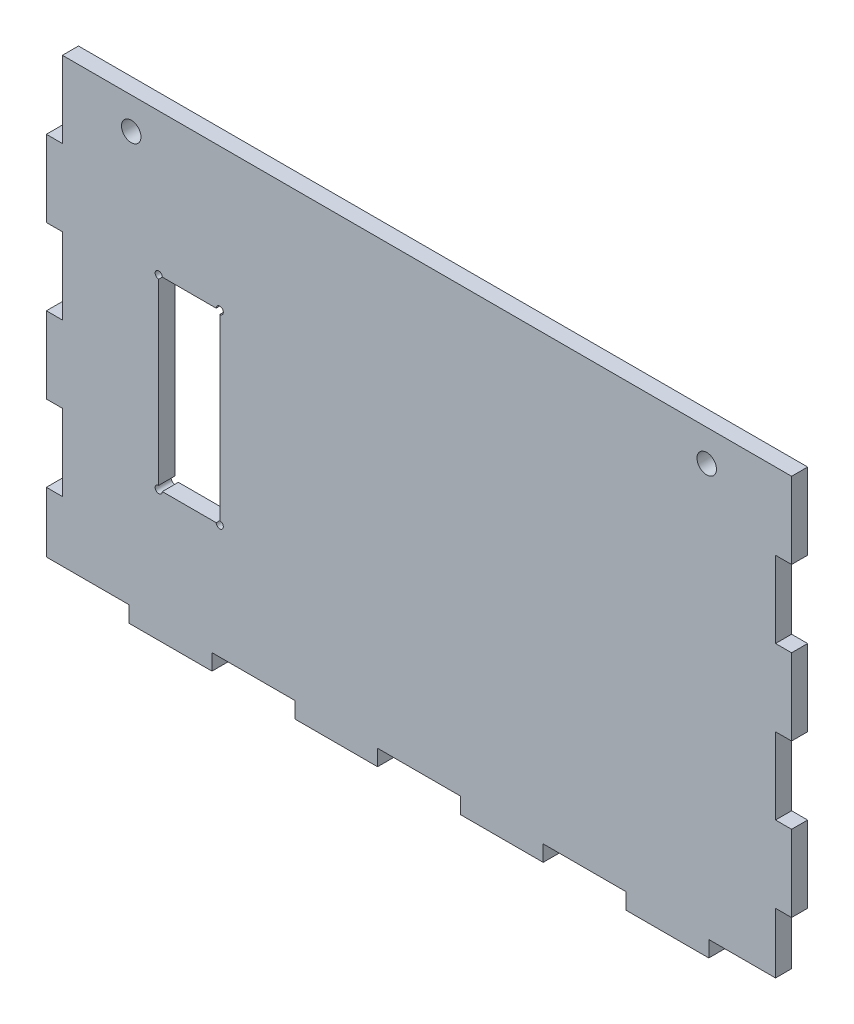
from build123d import *

# Parameters (mm, degrees)
SKETCH1_W           = 130
SKETCH1_H           = 80
BOSS_EXTRUDE1_DEPTH = 2.8
SKETCH2_W           = 14.444444444
SKETCH2_H           = 2.8
SKETCH2_W_2         = 2.8
SKETCH2_H_2         = 13.333333334
SKETCH2_H_3         = 13.333333333
CUT_EXTRUDE1_DEPTH  = 153.669053839
CUT_EXTRUDE2_REACH  = 154.669
SKETCH3_R           = 1.7
CUT_EXTRUDE3_REACH  = 154.669


with BuildPart() as part:
    # Sketch1 → Boss-Extrude1 (new body)
    with BuildSketch(Plane.XY):
        with Locations((65, 40)):
            Rectangle(SKETCH1_W, SKETCH1_H)
    extrude(amount=BOSS_EXTRUDE1_DEPTH)

    # Sketch2 → Cut-Extrude1 (cut, through all)
    with BuildSketch(Plane.XY.offset(2.8)):
        with Locations((7.222222222, 1.4)):
            Rectangle(SKETCH2_W, SKETCH2_H)
        with Locations((36.111111111, 1.4)):
            Rectangle(SKETCH2_W, SKETCH2_H)
        with Locations((65, 1.4)):
            Rectangle(SKETCH2_W, SKETCH2_H)
        with Locations((93.888888889, 1.4)):
            Rectangle(SKETCH2_W, SKETCH2_H)
        Polygon((115.555555556, 0), (115.555555556, 2.8), (127.2, 2.8), (127.2, 13.333333333), (130, 13.333333333), (130, 0), align=None)
        with Locations((1.4, 20)):
            Rectangle(SKETCH2_W_2, SKETCH2_H_2)
        with Locations((1.4, 46.666666667)):
            Rectangle(SKETCH2_W_2, SKETCH2_H_3)
        with Locations((1.4, 73.333333334)):
            Rectangle(SKETCH2_W_2, SKETCH2_H_3)
        with Locations((128.6, 33.333333334)):
            Rectangle(SKETCH2_W_2, SKETCH2_H_3)
        with Locations((128.6, 60)):
            Rectangle(SKETCH2_W_2, SKETCH2_H_2)
    extrude(amount=-CUT_EXTRUDE1_DEPTH, mode=Mode.SUBTRACT)

    # Sketch3 → Cut-Extrude2 (cut, up to next)
    with BuildSketch(Plane.XY.offset(2.8), mode=Mode.PRIVATE) as cut_extrude2_sk1:
        with Locations((14.8, 74.5)):
            Circle(SKETCH3_R)
    cut_extrude2_tool1 = extrude(cut_extrude2_sk1.sketch, amount=-CUT_EXTRUDE2_REACH, mode=Mode.PRIVATE) & part.part
    # Sketch3 → Cut-Extrude2 (cut, up to next)
    with BuildSketch(Plane.XY.offset(2.8), mode=Mode.PRIVATE) as cut_extrude2_sk2:
        with Locations(Location((115.2, 74.5, 0), (0, 0, 180))):
            Circle(SKETCH3_R)
    cut_extrude2_tool2 = extrude(cut_extrude2_sk2.sketch, amount=-CUT_EXTRUDE2_REACH, mode=Mode.PRIVATE) & part.part
    add(cut_extrude2_tool1.solids().sort_by_distance((14.8, 74.5, 2.8))[0], mode=Mode.SUBTRACT)
    add(cut_extrude2_tool2.solids().sort_by_distance((115.2, 74.5, 2.8))[0], mode=Mode.SUBTRACT)

    # Sketch4 → Cut-Extrude3 (cut, up to next)
    with BuildSketch(Plane(origin=(0, 0, 0), x_dir=(-1, 0, 0), z_dir=(0, 0, -1)), mode=Mode.PRIVATE) as cut_extrude3_sk1:
        with BuildLine():
            Line((-29.625, 55.2), (-20.225, 55.2))
            ThreePointArc((-20.225, 55.2), (-19.158058262, 55.641941738), (-19.6, 54.575))
            Line((-19.6, 54.575), (-19.6, 23.425))
            ThreePointArc((-19.6, 23.425), (-19.158058262, 22.358058262), (-20.225, 22.8))
            Line((-20.225, 22.8), (-29.625, 22.8))
            ThreePointArc((-29.625, 22.8), (-30.691941738, 22.358058262), (-30.25, 23.425))
            Line((-30.25, 23.425), (-30.25, 54.575))
            ThreePointArc((-30.25, 54.575), (-30.691941738, 55.641941738), (-29.625, 55.2))
        make_face()
    cut_extrude3_tool1 = extrude(cut_extrude3_sk1.sketch, amount=-CUT_EXTRUDE3_REACH, mode=Mode.PRIVATE) & part.part
    add(cut_extrude3_tool1.solids().sort_by_distance((24.925, 39, 0))[0], mode=Mode.SUBTRACT)


solid = part.part
